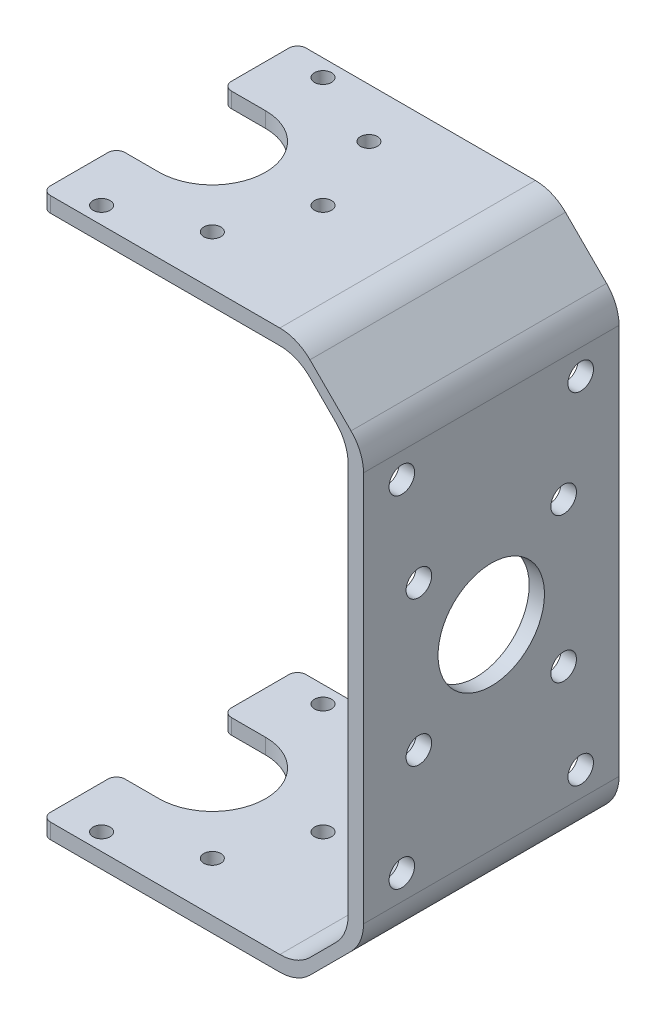
from build123d import *

# Parameters (mm, degrees)
SKETCH_1_W          = 30
SKETCH_1_H          = 50
EXTRUDE_1_DEPTH     = 0.9
SKETCH_2_R          = 6.25
SKETCH_2_R_2        = 1.5
CUT_EXTRUDE_1_DEPTH = 1.8
EXTRUDE_2_DEPTH     = 30
SKETCH_4_R          = 1
CUT_EXTRUDE_2_DEPTH = 1.8
FILLET_1_R          = 5
CUT_EXTRUDE_START   = -1.8
SKETCH_5_R          = 1
CUT_EXTRUDE_3_DEPTH = 1.8
FILLET_2_R          = 1


with BuildPart() as part:
    # ｽｹｯﾁ1 → ﾎﾞｽ - 押し出し1 (new, symmetric)
    with BuildSketch(Plane(origin=(0, 0, 0), x_dir=(0, 0, -1), z_dir=(1, 0, 0))):
        Rectangle(SKETCH_1_W, SKETCH_1_H)
    extrude(amount=EXTRUDE_1_DEPTH, both=True)

    # ｽｹｯﾁ2 → ｶｯﾄ - 押し出し1 (cut)
    with BuildSketch(Plane(origin=(0.9, 0, 0), x_dir=(0, 0, -1), z_dir=(1, 0, 0))):
        Circle(SKETCH_2_R)
        with Locations((-10.5, 20)):
            Circle(SKETCH_2_R_2)
        with Locations(Location((10.5, 20, 0), (0, 0, 180))):
            Circle(SKETCH_2_R_2)
        with Locations((10.5, -20)):
            Circle(SKETCH_2_R_2)
        with Locations(Location((-10.5, -20, 0), (0, 0, 180))):
            Circle(SKETCH_2_R_2)
        with Locations((-8.5, 8.5)):
            Circle(SKETCH_2_R_2)
        with Locations(Location((8.5, 8.5, 0), (0, 0, 180))):
            Circle(SKETCH_2_R_2)
        with Locations((8.5, -8.5)):
            Circle(SKETCH_2_R_2)
        with Locations(Location((-8.5, -8.5, 0), (0, 0, 180))):
            Circle(SKETCH_2_R_2)
    extrude(amount=-CUT_EXTRUDE_1_DEPTH, mode=Mode.SUBTRACT)

    # ｽｹｯﾁ3 → ﾎﾞｽ - 押し出し2 (add)
    with BuildSketch(Plane(origin=(0, 0, -15), x_dir=(-1, 0, 0), z_dir=(0, 0, -1))):
        Polygon((-0.9, 25), (6.85, 32.75), (36.85, 32.75), (36.85, 30.95), (7.85, 30.95), (6.85, 30.95), (0.9, 25), align=None)
    extrude_2 = extrude(amount=-EXTRUDE_2_DEPTH)

    # ｽｹｯﾁ4 → ｶｯﾄ - 押し出し2 (cut)
    with BuildSketch(Plane(origin=(0, 32.75, 0), x_dir=(1, 0, 0), z_dir=(0, 1, 0))):
        with BuildLine():
            ThreePointArc((-31.85, -6.25), (-25.6, 0), (-31.85, 6.25))
            Line((-31.85, 6.25), (-36.85, 6.25))
            Line((-36.85, 6.25), (-36.85, -6.25))
            Line((-36.85, -6.25), (-31.85, -6.25))
        make_face()
        with Locations(Location((-31.85, 13, 0), (0, 0, 270))):
            Circle(SKETCH_4_R)
        with Locations(Location((-22.657611845, 9.192388155, 0), (0, 0, 270))):
            Circle(SKETCH_4_R)
        with Locations(Location((-18.85, 0, 0), (0, 0, 270))):
            Circle(SKETCH_4_R)
        with Locations(Location((-22.657611845, -9.192388155, 0), (0, 0, 270))):
            Circle(SKETCH_4_R)
        with Locations(Location((-31.85, -13, 0), (0, 0, 270))):
            Circle(SKETCH_4_R)
    extrude(amount=-CUT_EXTRUDE_2_DEPTH, mode=Mode.SUBTRACT)

    # ﾐﾗｰ2: ﾎﾞｽ - 押し出し2 across plane
    add(extrude_2.mirror(Plane.ZX))

    # ﾌｨﾚｯﾄ1
    fillet_1_edges = [part.edges().sort_by_distance(p)[0] for p in [
        (-6.85, -30.95, 0),
        (-6.85, -32.75, 0),
        (0.9, -25, 0),
        (-0.9, -25, 0),
        (-6.85, 32.75, 0),
        (-6.85, 30.95, 0),
        (-0.9, 25, 0),
        (0.9, 25, 0),
    ]]
    fillet(fillet_1_edges, radius=FILLET_1_R)

    # ｽｹｯﾁ5 → ｶｯﾄ - 押し出し3 (cut)
    with BuildSketch(Plane.XZ.offset(32.75).offset(CUT_EXTRUDE_START)):
        with BuildLine():
            ThreePointArc((-31.85, -6.25), (-25.6, 0), (-31.85, 6.25))
            Line((-31.85, 6.25), (-36.85, 6.25))
            Line((-36.85, 6.25), (-36.85, -6.25))
            Line((-36.85, -6.25), (-31.85, -6.25))
        make_face()
        with Locations(Location((-31.85, 13, 0), (0, 0, 90))):
            Circle(SKETCH_5_R)
        with Locations(Location((-22.657611845, 9.192388155, 0), (0, 0, 90))):
            Circle(SKETCH_5_R)
        with Locations(Location((-18.85, 0, 0), (0, 0, 90))):
            Circle(SKETCH_5_R)
        with Locations(Location((-22.657611845, -9.192388155, 0), (0, 0, 90))):
            Circle(SKETCH_5_R)
        with Locations(Location((-31.85, -13, 0), (0, 0, 90))):
            Circle(SKETCH_5_R)
    extrude(amount=CUT_EXTRUDE_3_DEPTH, mode=Mode.SUBTRACT)

    # ﾌｨﾚｯﾄ2
    fillet_2_edges = [part.edges().sort_by_distance(p)[0] for p in [
        (-36.85, -31.85, -15),
        (-36.85, -31.85, 15),
        (-36.85, -31.85, -6.25),
        (-36.85, -31.85, 6.25),
        (-36.85, 31.85, 15),
        (-36.85, 31.85, -15),
        (-36.85, 31.85, 6.25),
        (-36.85, 31.85, -6.25),
    ]]
    fillet(fillet_2_edges, radius=FILLET_2_R)


solid = part.part
